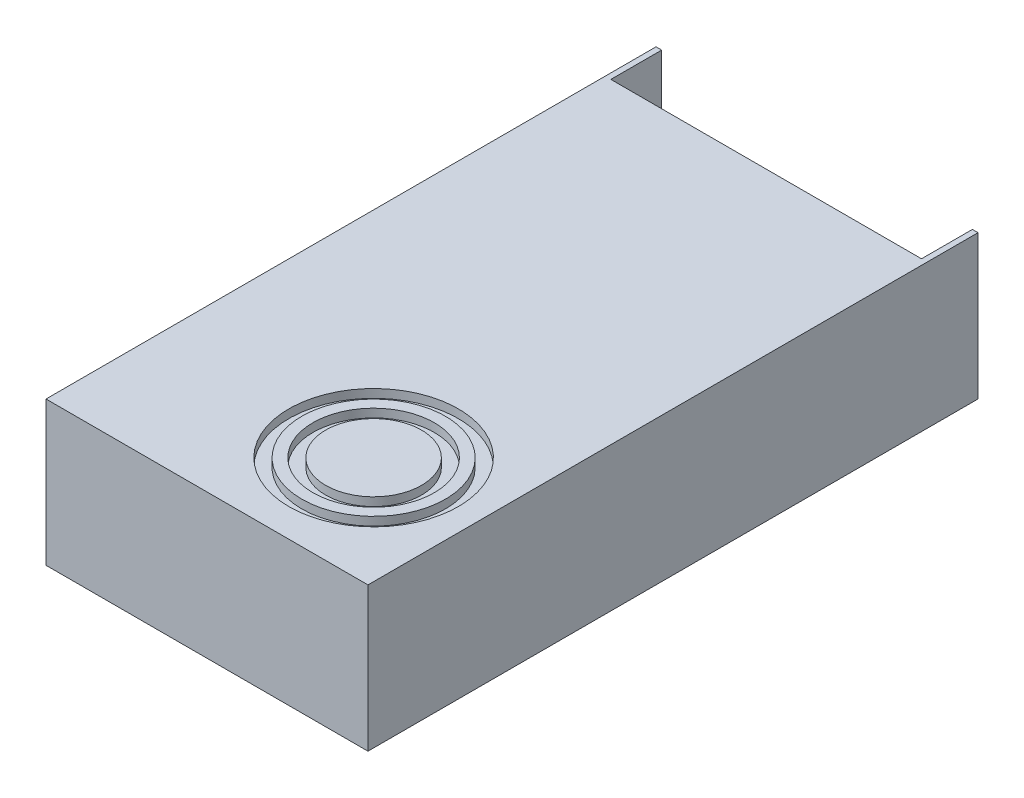
from build123d import *

# Parameters (mm, degrees)
SKETCH_2_W          = 114
SKETCH_2_H          = 216
EXTRUDE_2_DEPTH     = 51
SKETCH_3_R          = 1.5
SKETCH_3_R_2        = 2
CUT_EXTRUDE_1_DEPTH = 10
SKETCH_4_W          = 110
SKETCH_4_H          = 18
CUT_EXTRUDE_2_DEPTH = 42
SKETCH_5_W          = 87
SKETCH_5_H          = 16
EXTRUDE_3_DEPTH     = 17
SKETCH_6_R          = 30
SKETCH_6_R_2        = 25.436388115
CUT_EXTRUDE_4_DEPTH = 3
SKETCH_7_R          = 21.493717547
SKETCH_7_R_2        = 16.968980291
CUT_EXTRUDE_5_DEPTH = 3


with BuildPart() as part:
    # Эскиз2 → Бобышка-Вытянуть2 (new body)
    with BuildSketch(Plane(origin=(0, 0, 0), x_dir=(1, 0, 0), z_dir=(0, 1, 0))):
        with Locations((45.595035846, -62.514319432)):
            Rectangle(SKETCH_2_W, SKETCH_2_H)
    extrude(amount=EXTRUDE_2_DEPTH)

    # Эскиз3 → Вырез-Вытянуть1 (cut)
    with BuildSketch(Plane.XZ):
        with Locations(Location((-1.904964154, 160.514319432, 0), (0, 0, 270))):
            Circle(SKETCH_3_R)
        with Locations(Location((93.095035846, 160.514319432, 0), (0, 0, 270))):
            Circle(SKETCH_3_R)
        with Locations(Location((-1.904964154, -16.485680568, 0), (0, 0, 270))):
            Circle(SKETCH_3_R)
        with Locations(Location((93.095035846, -16.485680568, 0), (0, 0, 270))):
            Circle(SKETCH_3_R)
        with Locations(Location((20.595035846, 137.514319432, 0), (0, 0, 270))):
            Circle(SKETCH_3_R_2)
        with Locations(Location((70.595035846, 137.514319432, 0), (0, 0, 270))):
            Circle(SKETCH_3_R_2)
        with Locations(Location((20.595035846, -12.485680568, 0), (0, 0, 270))):
            Circle(SKETCH_3_R_2)
        with Locations(Location((70.595035846, -12.485680568, 0), (0, 0, 270))):
            Circle(SKETCH_3_R_2)
    extrude(amount=-CUT_EXTRUDE_1_DEPTH, mode=Mode.SUBTRACT)

    # Эскиз4 → Вырез-Вытянуть2 (cut)
    with BuildSketch(Plane(origin=(0, 51, 0), x_dir=(1, 0, 0), z_dir=(0, 1, 0))):
        with Locations((45.595035846, 36.485680568)):
            Rectangle(SKETCH_4_W, SKETCH_4_H)
    extrude(amount=-CUT_EXTRUDE_2_DEPTH, mode=Mode.SUBTRACT)

    # Эскиз5 → Бобышка-Вытянуть3 (add)
    with BuildSketch(Plane(origin=(0, 9, 0), x_dir=(1, 0, 0), z_dir=(0, 1, 0))):
        with Locations((35.880674643, 35.485680568)):
            Rectangle(SKETCH_5_W, SKETCH_5_H)
    extrude(amount=EXTRUDE_3_DEPTH)

    # Эскиз6 → Вырез-Вытянуть4 (cut)
    with BuildSketch(Plane(origin=(0, 51, 0), x_dir=(1, 0, 0), z_dir=(0, 1, 0))):
        with Locations(Location((64.595035846, -130.514319432, 0), (0, 0, 270))):
            Circle(SKETCH_6_R)
        with Locations(Location((64.595035846, -130.514319432, 0), (0, 0, 270))):
            Circle(SKETCH_6_R_2, mode=Mode.SUBTRACT)
    extrude(amount=-CUT_EXTRUDE_4_DEPTH, mode=Mode.SUBTRACT)

    # Эскиз7 → Вырез-Вытянуть5 (cut)
    with BuildSketch(Plane(origin=(0, 51, 0), x_dir=(1, 0, 0), z_dir=(0, 1, 0))):
        with Locations(Location((64.595035846, -130.514319432, 0), (0, 0, 270))):
            Circle(SKETCH_7_R)
        with Locations(Location((64.595035846, -130.514319432, 0), (0, 0, 270))):
            Circle(SKETCH_7_R_2, mode=Mode.SUBTRACT)
    extrude(amount=-CUT_EXTRUDE_5_DEPTH, mode=Mode.SUBTRACT)


solid = part.part
